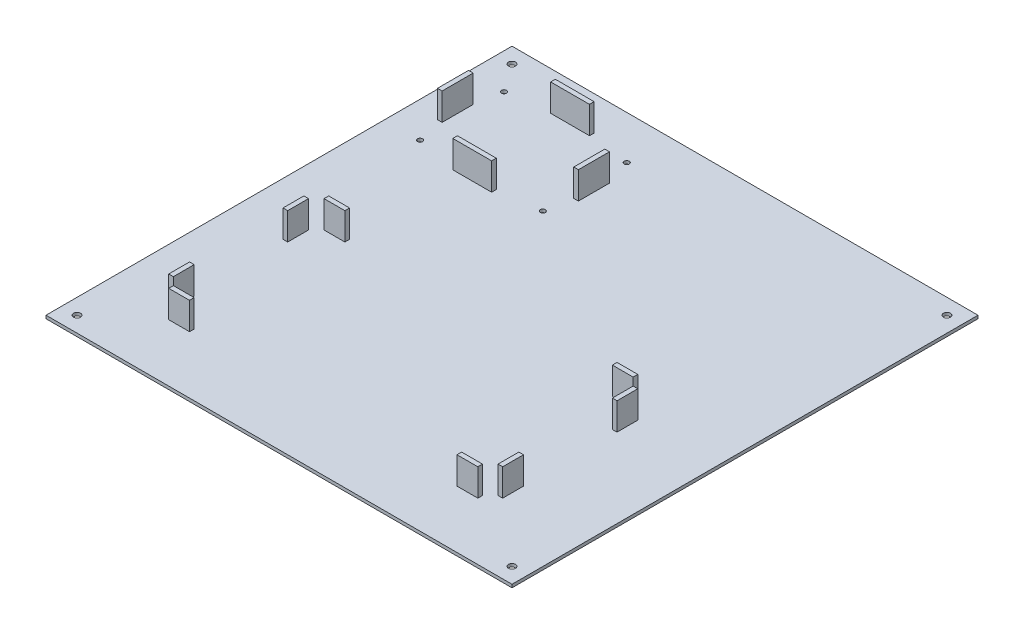
from build123d import *

# Parameters (mm, degrees)
SKETCH1_W           = 600
SKETCH1_H           = 600
BOSS_EXTRUDE1_DEPTH = 4
CUT_EXTRUDE1_REACH  = 850.538
SKETCH2_R           = 4.5
CUT_EXTRUDE2_REACH  = 850.538
SKETCH4_R           = 3.25
SKETCH4_3_W         = 6
SKETCH4_3_H         = 40
SKETCH4_3_W_2       = 50
SKETCH4_3_H_2       = 6
BOSS_EXTRUDE2_DEPTH = 35
SKETCH5_W           = 6
SKETCH5_H           = 26.8
SKETCH5_W_2         = 26.8
SKETCH5_H_2         = 6
BOSS_EXTRUDE3_DEPTH = 35


with BuildPart() as part:
    # Sketch1 → Boss-Extrude1 (new body)
    with BuildSketch(Plane(origin=(0, 0, 0), x_dir=(1, 0, 0), z_dir=(0, 1, 0))):
        with Locations((300, 300)):
            Rectangle(SKETCH1_W, SKETCH1_H)
    extrude(amount=BOSS_EXTRUDE1_DEPTH)

    # Sketch2 → Cut-Extrude1 (cut, up to next)
    with BuildSketch(Plane(origin=(0, 4, 0), x_dir=(1, 0, 0), z_dir=(0, 1, 0)), mode=Mode.PRIVATE) as cut_extrude1_sk1:
        with Locations((20, 580)):
            Circle(SKETCH2_R)
    cut_extrude1_tool1 = extrude(cut_extrude1_sk1.sketch, amount=-CUT_EXTRUDE1_REACH, mode=Mode.PRIVATE) & part.part
    # Sketch2 → Cut-Extrude1 (cut, up to next)
    with BuildSketch(Plane(origin=(0, 4, 0), x_dir=(1, 0, 0), z_dir=(0, 1, 0)), mode=Mode.PRIVATE) as cut_extrude1_sk2:
        with Locations((580, 580)):
            Circle(SKETCH2_R)
    cut_extrude1_tool2 = extrude(cut_extrude1_sk2.sketch, amount=-CUT_EXTRUDE1_REACH, mode=Mode.PRIVATE) & part.part
    # Sketch2 → Cut-Extrude1 (cut, up to next)
    with BuildSketch(Plane(origin=(0, 4, 0), x_dir=(1, 0, 0), z_dir=(0, 1, 0)), mode=Mode.PRIVATE) as cut_extrude1_sk3:
        with Locations((580, 20)):
            Circle(SKETCH2_R)
    cut_extrude1_tool3 = extrude(cut_extrude1_sk3.sketch, amount=-CUT_EXTRUDE1_REACH, mode=Mode.PRIVATE) & part.part
    # Sketch2 → Cut-Extrude1 (cut, up to next)
    with BuildSketch(Plane(origin=(0, 4, 0), x_dir=(1, 0, 0), z_dir=(0, 1, 0)), mode=Mode.PRIVATE) as cut_extrude1_sk4:
        with Locations((20, 20)):
            Circle(SKETCH2_R)
    cut_extrude1_tool4 = extrude(cut_extrude1_sk4.sketch, amount=-CUT_EXTRUDE1_REACH, mode=Mode.PRIVATE) & part.part
    add(cut_extrude1_tool1.solids().sort_by_distance((20, 4, -580))[0], mode=Mode.SUBTRACT)
    add(cut_extrude1_tool2.solids().sort_by_distance((580, 4, -580))[0], mode=Mode.SUBTRACT)
    add(cut_extrude1_tool3.solids().sort_by_distance((580, 4, -20))[0], mode=Mode.SUBTRACT)
    add(cut_extrude1_tool4.solids().sort_by_distance((20, 4, -20))[0], mode=Mode.SUBTRACT)

    # Sketch4 → Cut-Extrude2 (cut, up to next)
    with BuildSketch(Plane(origin=(0, 4, 0), x_dir=(1, 0, 0), z_dir=(0, 1, 0)), mode=Mode.PRIVATE) as cut_extrude2_sk1:
        with Locations((45.75, 544)):
            Circle(SKETCH4_R)
    cut_extrude2_tool1 = extrude(cut_extrude2_sk1.sketch, amount=-CUT_EXTRUDE2_REACH, mode=Mode.PRIVATE) & part.part
    # Sketch4 → Cut-Extrude2 (cut, up to next)
    with BuildSketch(Plane(origin=(0, 4, 0), x_dir=(1, 0, 0), z_dir=(0, 1, 0)), mode=Mode.PRIVATE) as cut_extrude2_sk2:
        with Locations((203.75, 544)):
            Circle(SKETCH4_R)
    cut_extrude2_tool2 = extrude(cut_extrude2_sk2.sketch, amount=-CUT_EXTRUDE2_REACH, mode=Mode.PRIVATE) & part.part
    # Sketch4 → Cut-Extrude2 (cut, up to next)
    with BuildSketch(Plane(origin=(0, 4, 0), x_dir=(1, 0, 0), z_dir=(0, 1, 0)), mode=Mode.PRIVATE) as cut_extrude2_sk3:
        with Locations((45.75, 436)):
            Circle(SKETCH4_R)
    cut_extrude2_tool3 = extrude(cut_extrude2_sk3.sketch, amount=-CUT_EXTRUDE2_REACH, mode=Mode.PRIVATE) & part.part
    # Sketch4 → Cut-Extrude2 (cut, up to next)
    with BuildSketch(Plane(origin=(0, 4, 0), x_dir=(1, 0, 0), z_dir=(0, 1, 0)), mode=Mode.PRIVATE) as cut_extrude2_sk4:
        with Locations((203.75, 436)):
            Circle(SKETCH4_R)
    cut_extrude2_tool4 = extrude(cut_extrude2_sk4.sketch, amount=-CUT_EXTRUDE2_REACH, mode=Mode.PRIVATE) & part.part
    add(cut_extrude2_tool1.solids().sort_by_distance((45.75, 4, -544))[0], mode=Mode.SUBTRACT)
    add(cut_extrude2_tool2.solids().sort_by_distance((203.75, 4, -544))[0], mode=Mode.SUBTRACT)
    add(cut_extrude2_tool3.solids().sort_by_distance((45.75, 4, -436))[0], mode=Mode.SUBTRACT)
    add(cut_extrude2_tool4.solids().sort_by_distance((203.75, 4, -436))[0], mode=Mode.SUBTRACT)

    # Sketch4<3> → Boss-Extrude2 (add)
    with BuildSketch(Plane(origin=(0, 4, 0), x_dir=(1, 0, 0), z_dir=(0, 1, 0))):
        with Locations((37, 490)):
            Rectangle(SKETCH4_3_W, SKETCH4_3_H)
        with Locations((124.75, 553)):
            Rectangle(SKETCH4_3_W_2, SKETCH4_3_H_2)
        with Locations((212.5, 490)):
            Rectangle(SKETCH4_3_W, SKETCH4_3_H)
        with Locations((124.75, 427)):
            Rectangle(SKETCH4_3_W_2, SKETCH4_3_H_2)
    extrude(amount=BOSS_EXTRUDE2_DEPTH)

    # Sketch5 → Boss-Extrude3 (add)
    with BuildSketch(Plane(origin=(0, 4, 0), x_dir=(1, 0, 0), z_dir=(0, 1, 0))):
        with Locations((495, 103.4)):
            Rectangle(SKETCH5_W, SKETCH5_H)
        with Locations((97.4, 277)):
            Rectangle(SKETCH5_W_2, SKETCH5_H_2)
        with Locations((71, 250.6)):
            Rectangle(SKETCH5_W, SKETCH5_H)
        with Locations((97.4, 77)):
            Rectangle(SKETCH5_W_2, SKETCH5_H_2)
        with Locations((495, 250.6)):
            Rectangle(SKETCH5_W, SKETCH5_H)
        with Locations((468.6, 277)):
            Rectangle(SKETCH5_W_2, SKETCH5_H_2)
        with Locations((71, 103.4)):
            Rectangle(SKETCH5_W, SKETCH5_H)
        with Locations((468.6, 77)):
            Rectangle(SKETCH5_W_2, SKETCH5_H_2)
    extrude(amount=BOSS_EXTRUDE3_DEPTH)


solid = part.part
